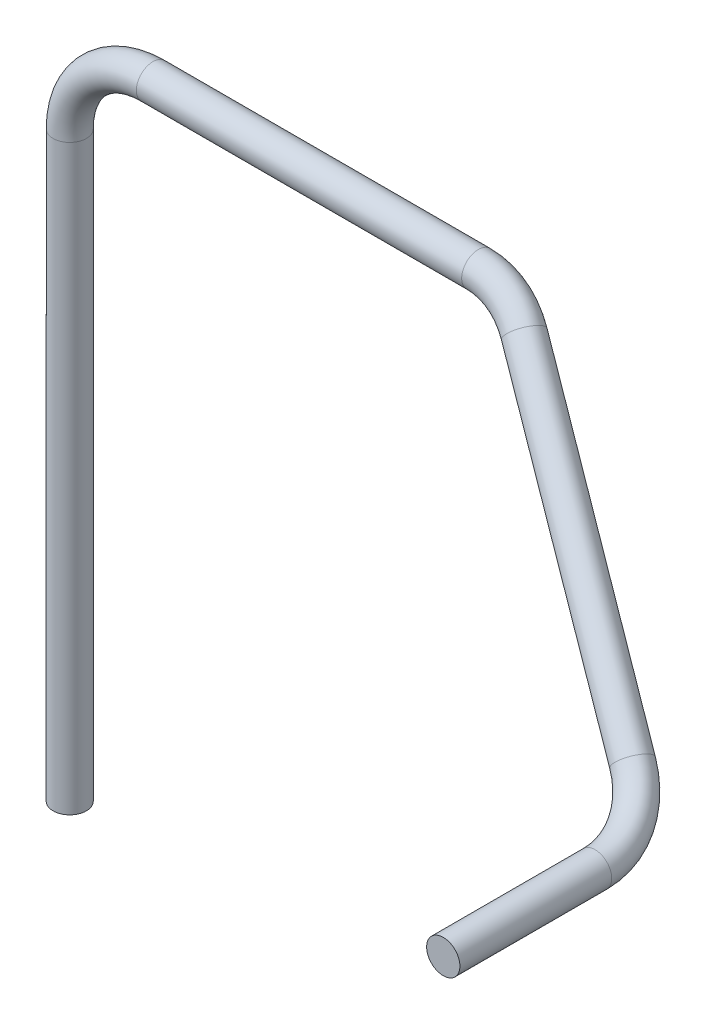
from build123d import *

# Parameters (mm, degrees)
SKETCH2_R = 2


with BuildPart() as part:
    # Sweep1: sweep along a curve in space
    with BuildLine() as sweep1_path:
        Line((0, 0, 0), (0, 70, 0))
        ThreePointArc((10, 80, 0), (2.928932188, 77.071067812, 0), (0, 70, 0))
        Line((10, 80, 0), (49.10931998, 80, 0))
        ThreePointArc((56.180387792, 77.514718626, 1.549845235), (52.936154304, 79.354096415, 0.402791653), (49.10931998, 80, 0))
        Line((56.180387792, 77.514718626, 1.549845235), (83.834853157, 54.049126638, 16.183212835))
        ThreePointArc((83.834853157, 54.049126638, 16.183212835), (87.302204622, 51.106981357, 19.862931701), (88.606794663, 50, 25.45683133))
        Line((88.606794663, 50, 25.45683133), (88.606794663, 50, 43.708286934))
    # Sketch2 → Sweep1 (sweep)
    with BuildSketch(Plane(origin=(0, 0, 0), x_dir=(1, 0, 0), z_dir=(0, 1, 0))):
        Circle(SKETCH2_R)
    sweep(path=sweep1_path.line)


solid = part.part
